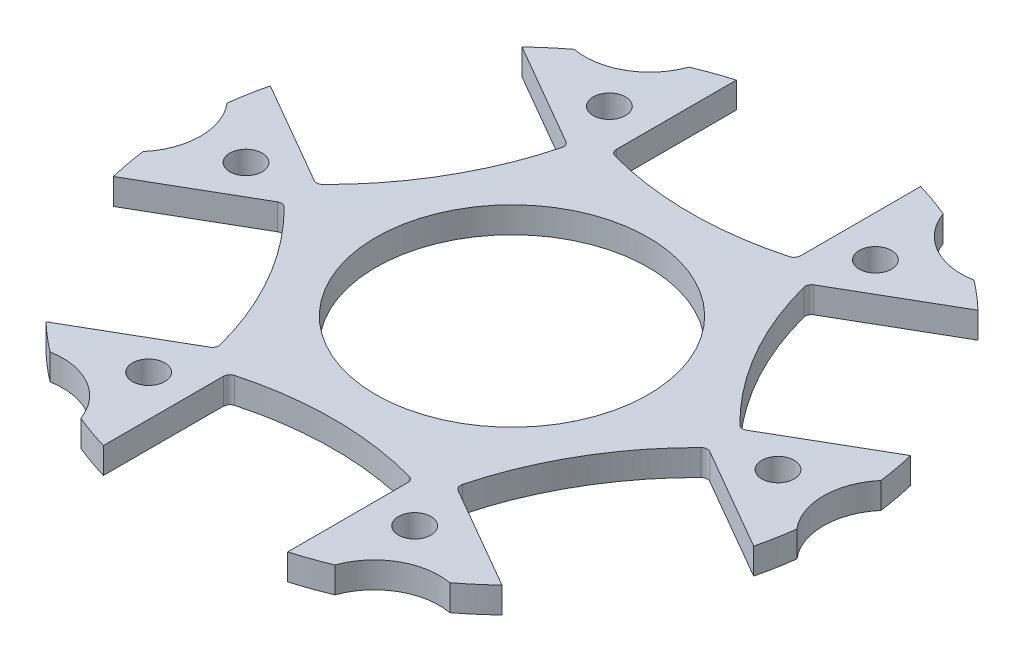
from build123d import *

# Parameters (mm, degrees)
SKETCH_1_R          = 25.4
SKETCH_1_R_2        = 10.5
EXTRUDE_1_DEPTH     = 2
CUT_EXTRUDE_1_DEPTH = 36.9766591
SKETCH_3_R          = 1.25
SKETCH_3_R_2        = 5
CUT_EXTRUDE_2_DEPTH = 36.269108296
FILLET_1_R          = 0.5


with BuildPart() as part:
    # 草图1 → 凸台-拉伸1 (new body)
    with BuildSketch(Plane(origin=(0, 0, 0), x_dir=(1, 0, 0), z_dir=(0, 1, 0))):
        with Locations(Location((0, 0, 0), (0, 0, 270))):
            Circle(SKETCH_1_R)
        with Locations(Location((0, 0, 0), (0, 0, 270))):
            Circle(SKETCH_1_R_2, mode=Mode.SUBTRACT)
    extrude(amount=EXTRUDE_1_DEPTH)

    # 草图2 → 切除-拉伸1 (cut, through all)
    with BuildSketch(Plane(origin=(0, 2, 0), x_dir=(1, 0, 0), z_dir=(0, 1, 0))):
        with BuildLine():
            Line((-7.1, 24.387496797), (-7.1, 14.762503203))
            ThreePointArc((-7.1, 14.762503203), (0, 13.75), (7.1, 14.762503203))
            Line((7.1, 14.762503203), (7.1, 24.387496797))
            ThreePointArc((7.1, 24.387496797), (0, 25.4), (-7.1, 24.387496797))
        make_face()
        with BuildLine():
            Line((17.57019176, 18.342528765), (9.234702798, 13.530031969))
            ThreePointArc((9.234702798, 13.530031969), (11.907849302, 6.875), (16.334702798, 1.232471235))
            Line((16.334702798, 1.232471235), (24.67019176, 6.044968031))
            ThreePointArc((24.67019176, 6.044968031), (21.997045256, 12.7), (17.57019176, 18.342528765))
        make_face()
        with BuildLine():
            Line((24.67019176, -6.044968031), (16.334702798, -1.232471235))
            ThreePointArc((16.334702798, -1.232471235), (11.907849302, -6.875), (9.234702798, -13.530031969))
            Line((9.234702798, -13.530031969), (17.57019176, -18.342528765))
            ThreePointArc((17.57019176, -18.342528765), (21.997045256, -12.7), (24.67019176, -6.044968031))
        make_face()
        with BuildLine():
            Line((7.1, -24.387496797), (7.1, -14.762503203))
            ThreePointArc((7.1, -14.762503203), (0, -13.75), (-7.1, -14.762503203))
            Line((-7.1, -14.762503203), (-7.1, -24.387496797))
            ThreePointArc((-7.1, -24.387496797), (0, -25.4), (7.1, -24.387496797))
        make_face()
        with BuildLine():
            Line((-17.57019176, -18.342528765), (-9.234702798, -13.530031969))
            ThreePointArc((-9.234702798, -13.530031969), (-11.907849302, -6.875), (-16.334702798, -1.232471235))
            Line((-16.334702798, -1.232471235), (-24.67019176, -6.044968031))
            ThreePointArc((-24.67019176, -6.044968031), (-21.997045256, -12.7), (-17.57019176, -18.342528765))
        make_face()
        with BuildLine():
            Line((-24.67019176, 6.044968031), (-16.334702798, 1.232471235))
            ThreePointArc((-16.334702798, 1.232471235), (-11.907849302, 6.875), (-9.234702798, 13.530031969))
            Line((-9.234702798, 13.530031969), (-17.57019176, 18.342528765))
            ThreePointArc((-17.57019176, 18.342528765), (-21.997045256, 12.7), (-24.67019176, 6.044968031))
        make_face()
    extrude(amount=-CUT_EXTRUDE_1_DEPTH, mode=Mode.SUBTRACT)

    # 草图3 → 切除-拉伸2 (cut, through all)
    with BuildSketch(Plane(origin=(0, 2, 0), x_dir=(1, 0, 0), z_dir=(0, 1, 0))):
        with Locations(Location((-10.25, 17.753520778, 0), (0, 0, 270))):
            Circle(SKETCH_3_R)
        with Locations(Location((10.25, 17.753520778, 0), (0, 0, 270))):
            Circle(SKETCH_3_R)
        with Locations(Location((20.5, 0, 0), (0, 0, 270))):
            Circle(SKETCH_3_R)
        with Locations(Location((10.25, -17.753520778, 0), (0, 0, 270))):
            Circle(SKETCH_3_R)
        with Locations(Location((-10.25, -17.753520778, 0), (0, 0, 270))):
            Circle(SKETCH_3_R)
        with Locations(Location((-20.5, 0, 0), (0, 0, 270))):
            Circle(SKETCH_3_R)
        with Locations((-29, 0)):
            Circle(SKETCH_3_R_2)
        with Locations((-14.5, 25.11473671)):
            Circle(SKETCH_3_R_2)
        with Locations((14.5, 25.11473671)):
            Circle(SKETCH_3_R_2)
        with Locations((29, 0)):
            Circle(SKETCH_3_R_2)
        with Locations((14.5, -25.11473671)):
            Circle(SKETCH_3_R_2)
        with Locations((-14.5, -25.11473671)):
            Circle(SKETCH_3_R_2)
    extrude(amount=-CUT_EXTRUDE_2_DEPTH, mode=Mode.SUBTRACT)

    # 圆角1
    fillet_1_edges = [part.edges().sort_by_distance(p)[0] for p in [
        (16.334702798, 1, -1.232471235),
        (9.234702798, 1, -13.530031969),
        (9.234702798, 1, 13.530031969),
        (16.334702798, 1, 1.232471235),
        (-7.1, 1, 14.762503203),
        (7.1, 1, 14.762503203),
        (-16.334702798, 1, 1.232471235),
        (-9.234702798, 1, 13.530031969),
        (-9.234702798, 1, -13.530031969),
        (-16.334702798, 1, -1.232471235),
        (7.1, 1, -14.762503203),
        (-7.1, 1, -14.762503203),
    ]]
    fillet(fillet_1_edges, radius=FILLET_1_R)


solid = part.part
